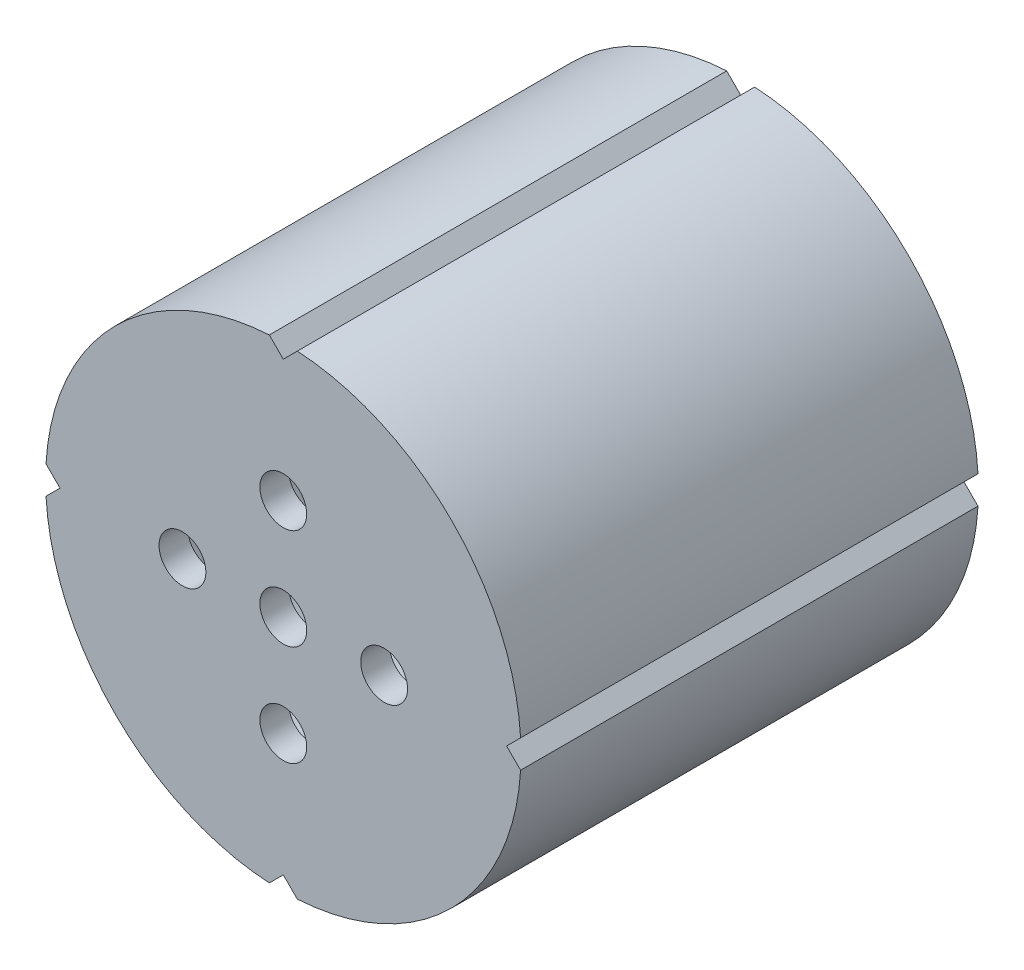
from build123d import *

# Parameters (mm, degrees)
CROQUIS1_R              = 1.625
SALIENTE_EXTRUIR1_DEPTH = 2
SALIENTE_EXTRUIR2_START = 29.75
CROQUIS3_R              = 15
SALIENTE_EXTRUIR2_DEPTH = 29.75


with BuildPart() as part:
    # Croquis1 → Saliente-Extruir1 (new body)
    with BuildSketch(Plane.XY):
        with BuildLine():
            Line((21.447717133, -26.771381771), (20.476335362, -25.8))
            Line((20.476335362, -25.8), (21.447717133, -24.828618229))
            ThreePointArc((21.447717133, -24.828618229), (16.643597251, -14.13273811), (5.947717133, -9.328618229))
            Line((5.947717133, -9.328618229), (4.976335362, -10.3))
            Line((4.976335362, -10.3), (4.00495359, -9.328618229))
            ThreePointArc((4.00495359, -9.328618229), (-6.690926528, -14.13273811), (-11.49504641, -24.828618229))
            Line((-11.49504641, -24.828618229), (-10.523664638, -25.8))
            Line((-10.523664638, -25.8), (-11.49504641, -26.771381771))
            ThreePointArc((-11.49504641, -26.771381771), (-6.690926528, -37.46726189), (4.00495359, -42.271381771))
            Line((4.00495359, -42.271381771), (4.976335362, -41.3))
            Line((4.976335362, -41.3), (5.947717133, -42.271381771))
            ThreePointArc((5.947717133, -42.271381771), (16.643597251, -37.46726189), (21.447717133, -26.771381771))
        make_face()
        with Locations((4.976335362, -25.8)):
            Circle(CROQUIS1_R, mode=Mode.SUBTRACT)
        with Locations((-2.023664638, -25.8)):
            Circle(CROQUIS1_R, mode=Mode.SUBTRACT)
        with Locations((4.976335362, -18.8)):
            Circle(CROQUIS1_R, mode=Mode.SUBTRACT)
        with Locations((11.976335362, -25.8)):
            Circle(CROQUIS1_R, mode=Mode.SUBTRACT)
        with Locations((4.976335362, -32.8)):
            Circle(CROQUIS1_R, mode=Mode.SUBTRACT)
    extrude(amount=SALIENTE_EXTRUIR1_DEPTH)

    # Croquis3 → Saliente-Extruir2 (add)
    with BuildSketch(Plane(origin=(0, 0, 0), x_dir=(-1, 0, 0), z_dir=(0, 0, -1)).offset(SALIENTE_EXTRUIR2_START)):
        with BuildLine():
            Line((-5.947717133, -9.328618229), (-4.976335362, -10.3))
            Line((-4.976335362, -10.3), (-4.00495359, -9.328618229))
            ThreePointArc((-4.00495359, -9.328618229), (6.690926528, -14.13273811), (11.49504641, -24.828618229))
            Line((11.49504641, -24.828618229), (10.523664638, -25.8))
            Line((10.523664638, -25.8), (11.49504641, -26.771381771))
            ThreePointArc((11.49504641, -26.771381771), (6.690926528, -37.46726189), (-4.00495359, -42.271381771))
            Line((-4.00495359, -42.271381771), (-4.976335362, -41.3))
            Line((-4.976335362, -41.3), (-5.947717133, -42.271381771))
            ThreePointArc((-5.947717133, -42.271381771), (-16.643597251, -37.46726189), (-21.447717133, -26.771381771))
            Line((-21.447717133, -26.771381771), (-20.476335362, -25.8))
            Line((-20.476335362, -25.8), (-21.447717133, -24.828618229))
            ThreePointArc((-21.447717133, -24.828618229), (-16.643597251, -14.13273811), (-5.947717133, -9.328618229))
        make_face()
        with Locations((-4.976335362, -25.8)):
            Circle(CROQUIS3_R, mode=Mode.SUBTRACT)
    extrude(amount=-SALIENTE_EXTRUIR2_DEPTH)


solid = part.part
